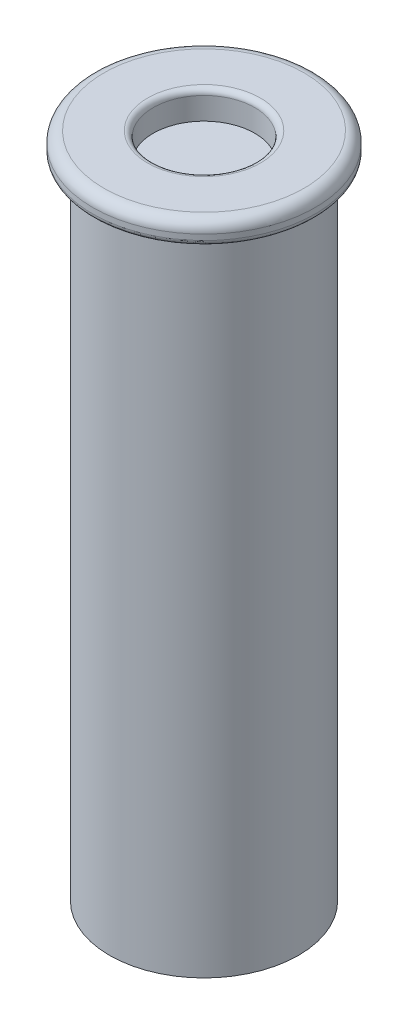
from build123d import *

# Parameters (mm, degrees)
SKETCH2_R          = 17
EXTRUSION4_DEPTH   = 10
SKETCH3_R          = 9.15
EXTRUSION5_DEPTH   = 5
FILLET2_R          = 1
FILLET3_R          = 2
FILLET4_R          = 1
FILLET5_R          = 1
SKETCH4_R          = 2.75
CUT_EXTRUDE3_DEPTH = 12
SKETCH5_R          = 3.25
CUT_EXTRUDE4_DEPTH = 1


with BuildPart() as part:
    # Sketch1 → Revolution1 (revolve)
    with BuildSketch(Plane.XY, mode=Mode.PRIVATE) as revolution1_sk:
        Polygon((17, 0), (17, 106), (20, 106), (20, 110), (0, 110), (0, 0), align=None)
    revolve(revolution1_sk.sketch.rotate(Axis((0, 0, 0), (0, 1, 0)), 90), axis=Axis((0, 0, 0), (0, 1, 0)))

    # Sketch2 → Extrusion4 (add)
    with BuildSketch(Plane.XZ):
        with Locations(Location((0, 0, 0), (0, 0, 270))):
            Circle(SKETCH2_R)
    extrude(amount=EXTRUSION4_DEPTH)

    # Sketch3 → Extrusion5 (cut)
    with BuildSketch(Plane(origin=(0, 110, 0), x_dir=(-1, 0, 0), z_dir=(0, 1, 0))):
        with Locations(Location((0, 0, 0), (0, 0, 90))):
            Circle(SKETCH3_R)
    extrude(amount=-EXTRUSION5_DEPTH, mode=Mode.SUBTRACT)

    # Fillet2
    fillet2_edges = [part.edges().sort_by_distance(p)[0] for p in [
        (0, 110, -9.15),
    ]]
    fillet(fillet2_edges, radius=FILLET2_R)

    # Fillet3
    fillet3_edges = [part.edges().sort_by_distance(p)[0] for p in [
        (0, 110, 20),
    ]]
    fillet(fillet3_edges, radius=FILLET3_R)

    # Fillet4
    fillet4_edges = [part.edges().sort_by_distance(p)[0] for p in [
        (0, 106, 20),
    ]]
    fillet(fillet4_edges, radius=FILLET4_R)

    # Fillet5
    fillet5_edges = [part.edges().sort_by_distance(p)[0] for p in [
        (0, 106, 17),
    ]]
    fillet(fillet5_edges, radius=FILLET5_R)

    # Sketch4 → Cut-Extrude3 (cut)
    with BuildSketch(Plane.XZ.offset(10)):
        with Locations(Location((0, 0, 0), (0, 0, 270))):
            Circle(SKETCH4_R)
    extrude(amount=-CUT_EXTRUDE3_DEPTH, mode=Mode.SUBTRACT)

    # Sketch5 → Cut-Extrude4 (cut)
    with BuildSketch(Plane.XZ.offset(10)):
        with Locations(Location((0, 0, 0), (0, 0, 270))):
            Circle(SKETCH5_R)
    extrude(amount=-CUT_EXTRUDE4_DEPTH, mode=Mode.SUBTRACT)


solid = part.part
